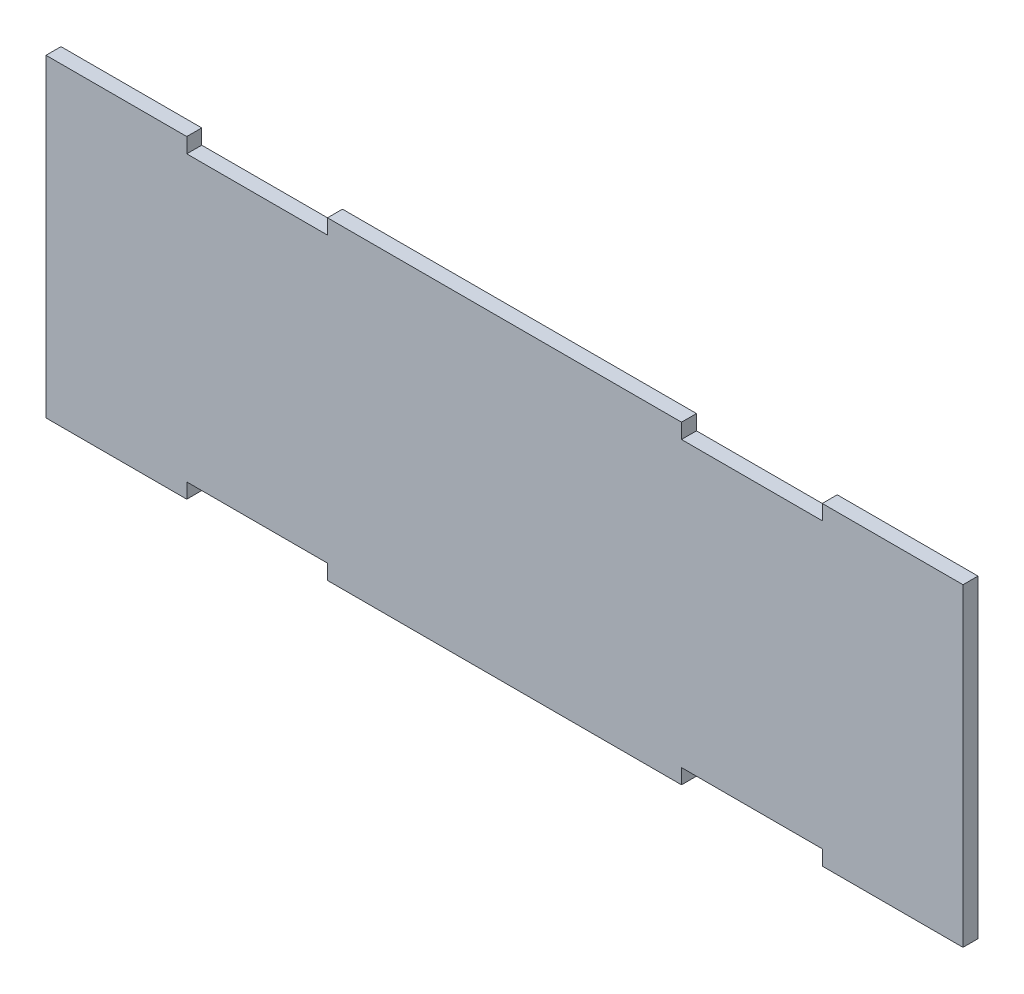
from build123d import *

# Parameters (mm, degrees)
BOSS_EXTRUDE1_DEPTH = 5.4102


with BuildPart() as part:
    # Sketch1 → Boss-Extrude1 (new body)
    with BuildSketch(Plane.XY):
        Polygon((-165.481, 56.680227), (-165.481, 0), (165.481, 0), (165.481, 56.680227), (114.681, 56.680227), (114.681, 51.270027), (63.881, 51.270027), (63.881, 56.680227), (-63.881, 56.680227), (-63.881, 51.270027), (-114.681, 51.270027), (-114.681, 56.680227), align=None)
        Polygon((-165.481, 0), (-165.481, -56.680227), (-114.681, -56.680227), (-114.681, -51.270027), (-63.881, -51.270027), (-63.881, -56.680227), (63.881, -56.680227), (63.881, -51.270027), (114.681, -51.270027), (114.681, -56.680227), (165.481, -56.680227), (165.481, 0), align=None)
    extrude(amount=BOSS_EXTRUDE1_DEPTH)


solid = part.part
